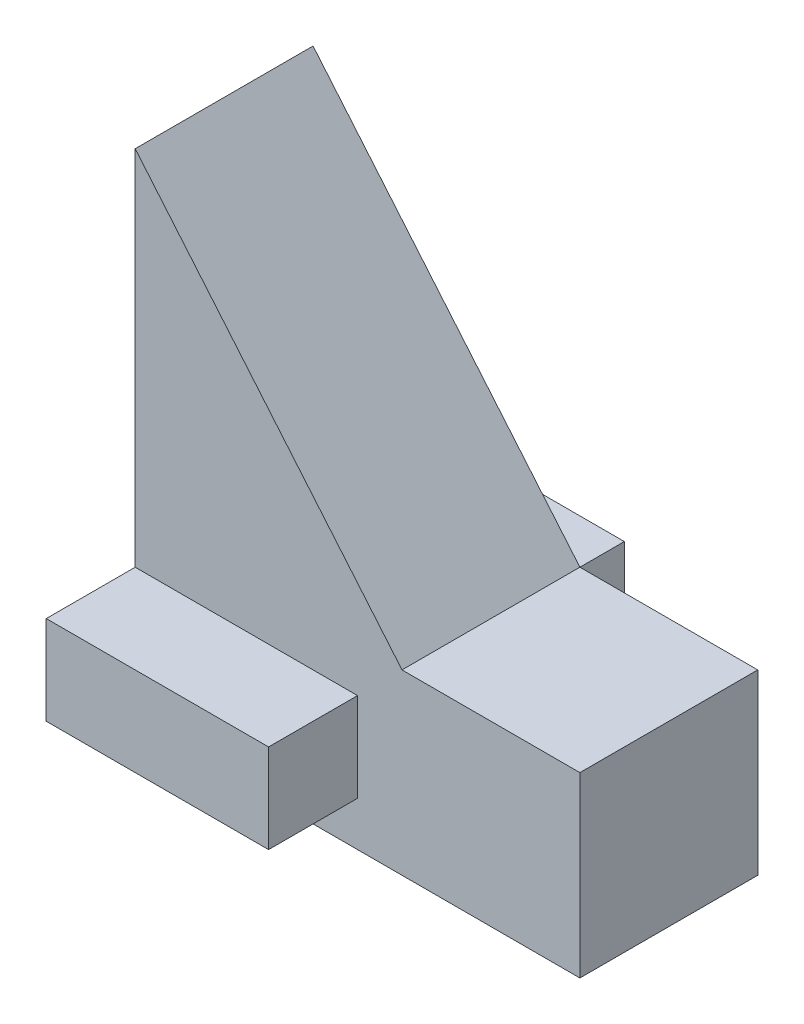
from build123d import *

# Parameters (mm, degrees)
BOSS_EXTRU_1_DEPTH = 4
ESQUISSE2_W        = 5
ESQUISSE2_H        = 2
BOSS_EXTRU_2_DEPTH = 2


with BuildPart() as part:
    # Esquisse1 → Boss.-Extru.1 (new body)
    with BuildSketch(Plane.XY):
        Polygon((21.610352861, -2.991005838), (25.610352861, -2.991005838), (25.610352861, -6.991005838), (15.610352861, -6.991005838), (15.610352861, 4.159515718), align=None)
    extrude(amount=BOSS_EXTRU_1_DEPTH)

    # Esquisse2 → Boss.-Extru.2 (add)
    with BuildSketch(Plane.XY.offset(4)):
        with Locations((18.110352861, -4.991005838)):
            Rectangle(ESQUISSE2_W, ESQUISSE2_H)
    boss_extru_2 = extrude(amount=BOSS_EXTRU_2_DEPTH)

    # Symétrie1: Boss.-Extru.2 across plane
    add(boss_extru_2.mirror(Plane.XY.offset(2)))


solid = part.part
